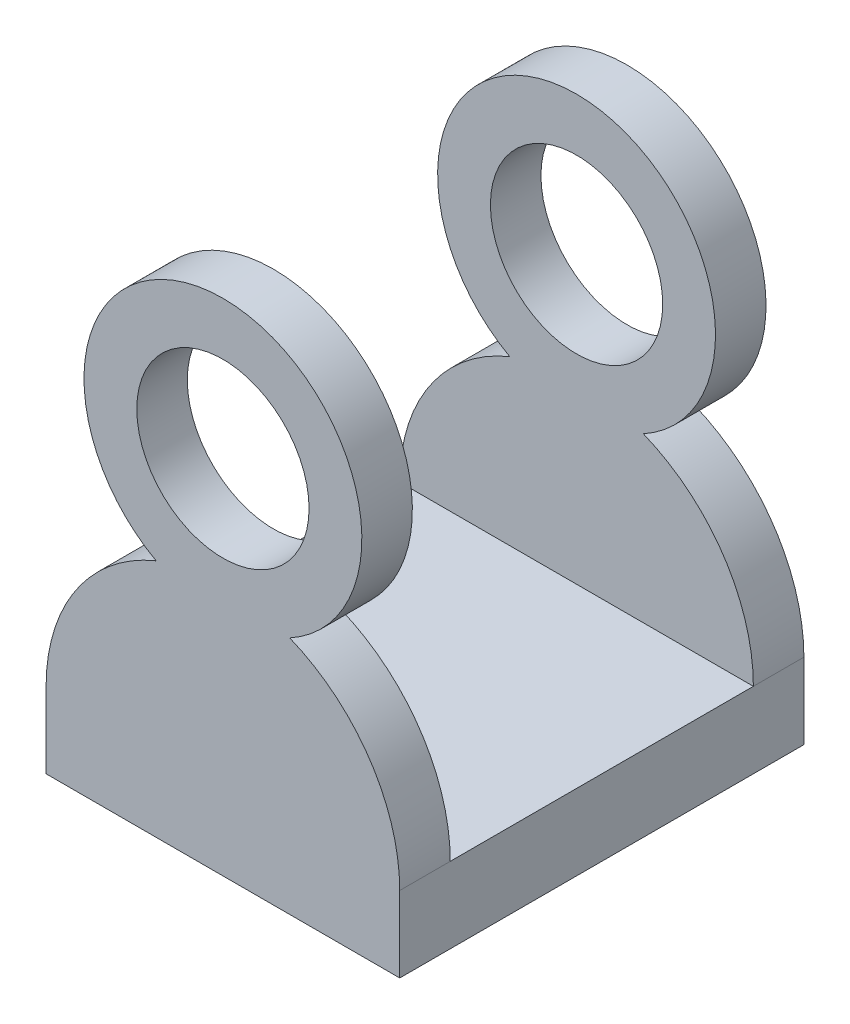
from build123d import *

# Parameters (mm, degrees)
SKETCH1_W           = 14
SKETCH1_H           = 3
BOSS_EXTRUDE1_DEPTH = 16
BOSS_EXTRUDE2_DEPTH = 2
SKETCH3_R           = 3.41
CUT_EXTRUDE2_DEPTH  = 7.8


with BuildPart() as part:
    # Sketch1 → Boss-Extrude1 (new body)
    with BuildSketch(Plane.XY):
        Rectangle(SKETCH1_W, SKETCH1_H)
    extrude(amount=BOSS_EXTRUDE1_DEPTH)

    # Sketch2 → Boss-Extrude2 (add)
    with BuildSketch(Plane.XY.offset(16)):
        with BuildLine():
            Line((-7, 1.5), (7, 1.5))
            ThreePointArc((7, 1.5), (5.80980001, 5.404641321), (2.643936044, 7.981481481))
            ThreePointArc((2.643936044, 7.981481481), (0, 18.30430246), (-2.643936044, 7.981481481))
            ThreePointArc((-2.643936044, 7.981481481), (-5.80980001, 5.404641321), (-7, 1.5))
        make_face()
    boss_extrude2 = extrude(amount=-BOSS_EXTRUDE2_DEPTH)

    # Sketch3 → Cut-Extrude2 (cut)
    with BuildSketch(Plane.XY.offset(16)):
        with Locations((0, 12.80430246)):
            Circle(SKETCH3_R)
    cut_extrude2 = extrude(amount=-CUT_EXTRUDE2_DEPTH, mode=Mode.SUBTRACT)

    # Mirror1: Boss-Extrude2, Cut-Extrude2 across plane
    add(boss_extrude2.mirror(Plane(origin=(0, 0, 8), x_dir=(1, 0, 0), z_dir=(0, 0, -1))))
    add(cut_extrude2.mirror(Plane(origin=(0, 0, 8), x_dir=(1, 0, 0), z_dir=(0, 0, -1))), mode=Mode.SUBTRACT)


solid = part.part
